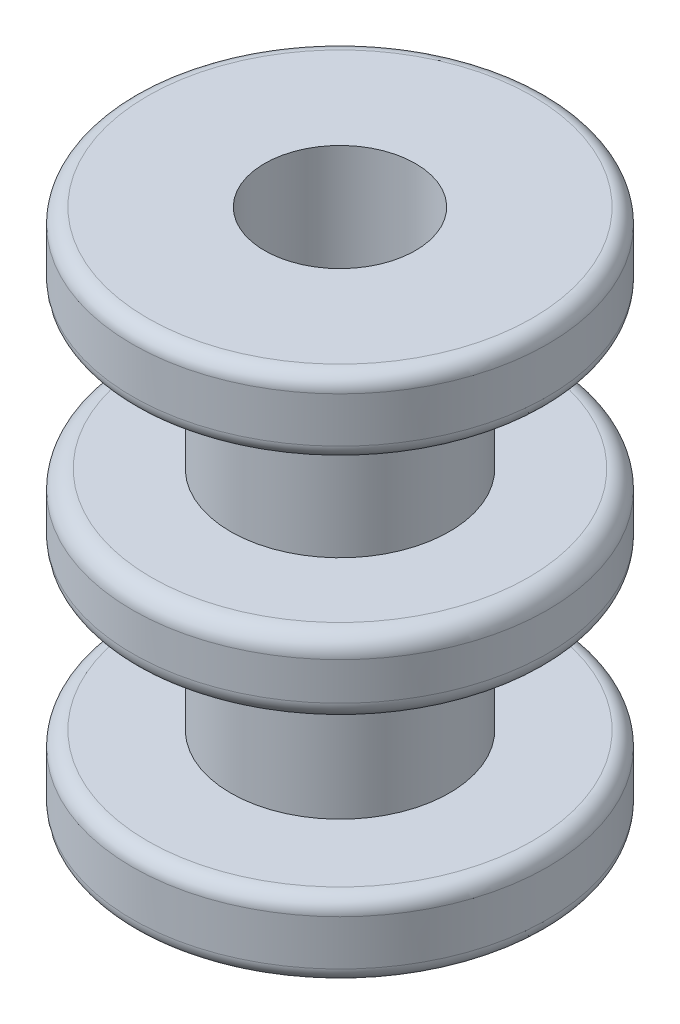
from build123d import *

# Parameters (mm, degrees)
FILLET_1_R = 0.5
FILLET_2_R = 0.4


with BuildPart() as part:
    # 草图1 → 旋转1 (revolve)
    with BuildSketch(Plane.XY, mode=Mode.PRIVATE) as revolve_1_sk:
        Polygon((2, 7), (5.5, 7), (5.5, 5), (2.9, 5), (2.9, 1), (5.5, 1), (5.5, -1), (2.9, -1), (2.9, -5), (5.5, -5), (5.5, -7), (2, -7), align=None)
    revolve(revolve_1_sk.sketch.rotate(Axis((0, -9.632847305, 0), (0, 1, 0)), 90), axis=Axis((0, -9.632847305, 0), (0, 1, 0)))

    # 圆角1
    fillet_1_edges = [part.edges().sort_by_distance(p)[0] for p in [
        (0, 1, 5.5),
        (0, -1, 5.5),
    ]]
    fillet(fillet_1_edges, radius=FILLET_1_R)

    # 圆角2
    fillet_2_edges = [part.edges().sort_by_distance(p)[0] for p in [
        (0, 5, 5.5),
        (0, -5, 5.5),
        (0, -7, 5.5),
        (0, 7, 5.5),
    ]]
    fillet(fillet_2_edges, radius=FILLET_2_R)


solid = part.part
